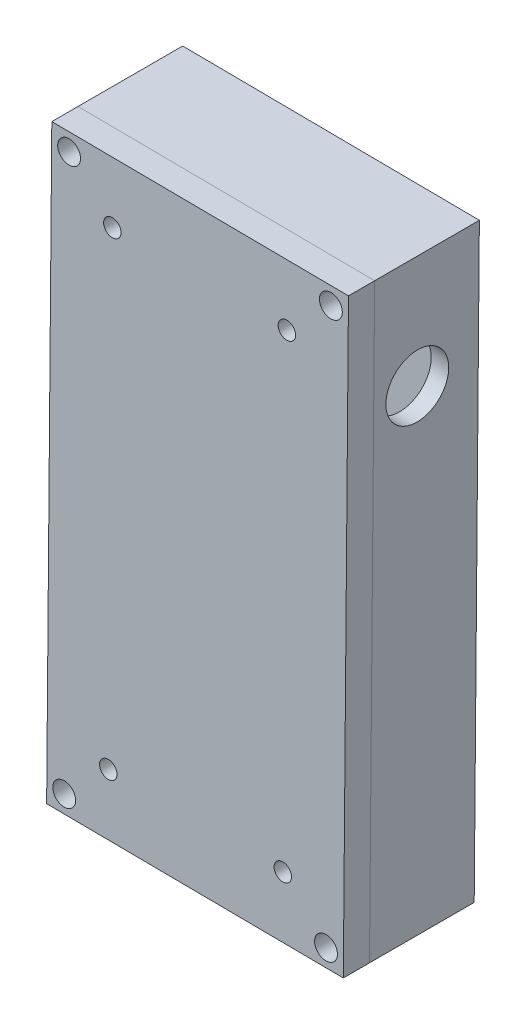
from build123d import *

# Parameters (mm, degrees)
SKETCH2_R               = 0.8115
BOSS_EXTRUDE1_DEPTH     = 12
BOSS_EXTRUDE2_DEPTH     = 2
SKETCH4_R               = 3.6
CUT_EXTRUDE1_DEPTH      = 3
SKETCH5_R               = 3.6
CUT_EXTRUDE2_DEPTH      = 3
SKETCH10_R              = 1.3115
BOSS_EXTRUDE3_DEPTH     = 3
CUT_EXTRUDE3_DEPTH      = 58.802809601
CUT_EXTRUDE3_DEPTH_BACK = 58.802809601
SKETCH11_R              = 1


with BuildPart() as part:
    # Sketch2 → Boss-Extrude1 (new body)
    with BuildSketch(Plane.XY.offset(10)):
        Polygon((22.642908935, -51.305750842), (23.235419693, 16.691667719), (-10.763289588, 16.987923098), (-11.355800345, -51.009495464), align=None)
        with Locations((-9.338449483, -49.026998175)):
            Circle(SKETCH2_R, mode=Mode.SUBTRACT)
        with Locations((20.660411647, -49.28839998)):
            Circle(SKETCH2_R, mode=Mode.SUBTRACT)
        with Locations((-8.7807923, 14.970572235)):
            Circle(SKETCH2_R, mode=Mode.SUBTRACT)
        with Locations((21.21806883, 14.709170431)):
            Circle(SKETCH2_R, mode=Mode.SUBTRACT)
        with BuildLine():
            Line((-9.294882486, -44.027187957), (-8.824359238, 9.970762017))
            ThreePointArc((-8.824359238, 9.970762017), (-7.32914224, 13.493401237), (-3.780982082, 14.927005238))
            Line((-3.780982082, 14.927005238), (16.218258612, 14.752737369))
            ThreePointArc((16.218258612, 14.752737369), (19.740897831, 13.257520371), (21.174501833, 9.709360213))
            Line((21.174501833, 9.709360213), (20.703978585, -44.288589762))
            ThreePointArc((20.703978585, -44.288589762), (19.208761587, -47.811228981), (15.660601429, -49.244832982))
            Line((15.660601429, -49.244832982), (-4.338639265, -49.070565113))
            ThreePointArc((-4.338639265, -49.070565113), (-7.861278484, -47.575348116), (-9.294882486, -44.027187957))
        make_face(mode=Mode.SUBTRACT)
    extrude(amount=-BOSS_EXTRUDE1_DEPTH)

    # Sketch3 → Boss-Extrude2 (add)
    with BuildSketch(Plane(origin=(0, 0, -2), x_dir=(-1, 0, 0), z_dir=(0, 0, -1))):
        Polygon((-22.642908935, -51.305750842), (11.355800345, -51.009495464), (10.763289588, 16.987923098), (-23.235419693, 16.691667719), align=None)
    extrude(amount=-BOSS_EXTRUDE2_DEPTH)

    # Sketch4 → Cut-Extrude1 (cut)
    with BuildSketch(Plane(origin=(-10.910489244, 0.095070995, 0), x_dir=(0, 0, -1), z_dir=(-0.9999620376663749, 0.008713393489992394, 0))):
        with Locations(Location((-5, 38.106506551, 0), (0, 0, 90))):
            Circle(SKETCH4_R)
    extrude(amount=-CUT_EXTRUDE1_DEPTH, mode=Mode.SUBTRACT)

    # Sketch5 → Cut-Extrude2 (cut)
    with BuildSketch(Plane(origin=(23.088220037, -0.201184384, 0), x_dir=(0, 0, 1), z_dir=(0.9999620376663749, -0.008713393489992394, 0))):
        with Locations(Location((5, -3.893493389, 0), (0, 0, 270))):
            Circle(SKETCH5_R)
    extrude(amount=-CUT_EXTRUDE2_DEPTH, mode=Mode.SUBTRACT)


with BuildPart() as body_2:
    # Sketch10 → Boss-Extrude3 (new body)
    with BuildSketch(Plane.XY.offset(10)):
        Polygon((-11.355800345, -51.009495464), (22.642908935, -51.305750842), (23.235419693, 16.691667719), (-10.763289588, 16.987923098), align=None)
        with Locations((20.660411647, -49.28839998)):
            Circle(SKETCH10_R, mode=Mode.SUBTRACT)
        with Locations((21.21806883, 14.709170431)):
            Circle(SKETCH10_R, mode=Mode.SUBTRACT)
        with Locations((-8.7807923, 14.970572235)):
            Circle(SKETCH10_R, mode=Mode.SUBTRACT)
        with Locations((-9.338449483, -49.026998175)):
            Circle(SKETCH10_R, mode=Mode.SUBTRACT)
    extrude(amount=BOSS_EXTRUDE3_DEPTH)


with BuildPart() as cut_extrude3_tool:
    # Sketch11 → Cut-Extrude3 (new, two sides: drawn at the far end of the back side and taken through both)
    with BuildSketch(Plane.XY.offset(-CUT_EXTRUDE3_DEPTH_BACK)):
        with Locations((16.174691644, 9.75292718)):
            Circle(SKETCH11_R)
        with Locations((-3.824549049, 9.92719505)):
            Circle(SKETCH11_R)
        with Locations((15.704168396, -44.245022794)):
            Circle(SKETCH11_R)
        with Locations((-4.295072297, -44.070754925)):
            Circle(SKETCH11_R)
    extrude(amount=CUT_EXTRUDE3_DEPTH + CUT_EXTRUDE3_DEPTH_BACK)


with BuildPart() as part_1:
    add(part.part)

    # Cut-Extrude3: cut by cut_extrude3_tool
    add(cut_extrude3_tool.part, mode=Mode.SUBTRACT)


with BuildPart() as body_2_1:
    add(body_2.part)

    # Cut-Extrude3: cut by cut_extrude3_tool
    add(cut_extrude3_tool.part, mode=Mode.SUBTRACT)


solid = Compound([part_1.part, body_2_1.part])
